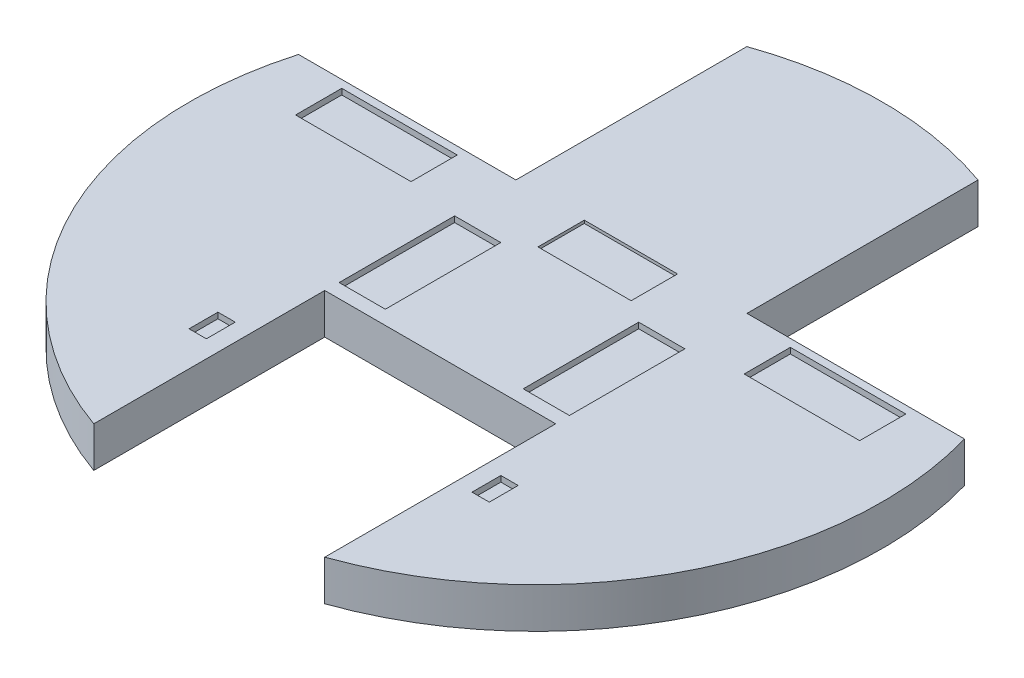
from build123d import *

# Parameters (mm, degrees)
BOSS_EXTRUDE1_DEPTH = 17.78
SKETCH2_W           = 41
SKETCH2_H           = 20.4
CUT_EXTRUDE1_DEPTH  = 1.27
SKETCH3_W           = 7.62
SKETCH3_H           = 12.7
CUT_EXTRUDE2_DEPTH  = 2.54
SKETCH4_W           = 50.8
SKETCH4_H           = 20.32
SKETCH4_W_2         = 20.32
SKETCH4_H_2         = 50.8
CUT_EXTRUDE3_DEPTH  = 2.54


with BuildPart() as part:
    # Sketch1 → Boss-Extrude1 (new body)
    with BuildSketch(Plane(origin=(0, 0, 0), x_dir=(1, 0, 0), z_dir=(0, 1, 0))):
        with BuildLine():
            Line((50.8, -42.084097937), (-50.8, -42.084097937))
            Line((-50.8, -42.084097937), (-50.8, -143.684097937))
            ThreePointArc((-50.8, -143.684097937), (-135.481402596, -69.789322613), (-146.480963287, 42.060520616))
            Line((-146.480963287, 42.060520616), (-50.866637556, 42.060520616))
            Line((-50.866637556, 42.060520616), (-50.866637556, 143.660520616))
            ThreePointArc((-50.866637556, 143.660520616), (-0.035342799, 152.399995902), (50.8, 143.684097937))
            Line((50.8, 143.684097937), (50.8, 42.060520616))
            Line((50.8, 42.060520616), (146.480963287, 42.060520616))
            ThreePointArc((146.480963287, 42.060520616), (135.481402596, -69.789322613), (50.8, -143.684097937))
            Line((50.8, -143.684097937), (50.8, -42.084097937))
        make_face()
    extrude(amount=BOSS_EXTRUDE1_DEPTH)

    # Sketch2 → Cut-Extrude1 (cut)
    with BuildSketch(Plane(origin=(0, 17.78, 0), x_dir=(1, 0, 0), z_dir=(0, 1, 0))):
        with Locations((0, 31.598605784)):
            Rectangle(SKETCH2_W, SKETCH2_H)
    extrude(amount=-CUT_EXTRUDE1_DEPTH, mode=Mode.SUBTRACT)

    # Sketch3 → Cut-Extrude2 (cut)
    with BuildSketch(Plane(origin=(0, 17.78, 0), x_dir=(1, 0, 0), z_dir=(0, 1, 0))):
        with Locations((-62.23, -80.184097937)):
            Rectangle(SKETCH3_W, SKETCH3_H)
        with Locations((62.23, -80.184097937)):
            Rectangle(SKETCH3_W, SKETCH3_H)
    extrude(amount=-CUT_EXTRUDE2_DEPTH, mode=Mode.SUBTRACT)

    # Sketch4 → Cut-Extrude3 (cut)
    with BuildSketch(Plane(origin=(0, 17.78, 0), x_dir=(1, 0, 0), z_dir=(0, 1, 0))):
        with Locations((-98.673800421, 28.511480762)):
            Rectangle(SKETCH4_W, SKETCH4_H)
        with Locations((98.673800421, 28.511480762)):
            Rectangle(SKETCH4_W, SKETCH4_H)
        with Locations((-40.485390627, -10.503849142)):
            Rectangle(SKETCH4_W_2, SKETCH4_H_2)
        with Locations((40.485644605, -10.503849142)):
            Rectangle(SKETCH4_W_2, SKETCH4_H_2)
    extrude(amount=-CUT_EXTRUDE3_DEPTH, mode=Mode.SUBTRACT)


solid = part.part
